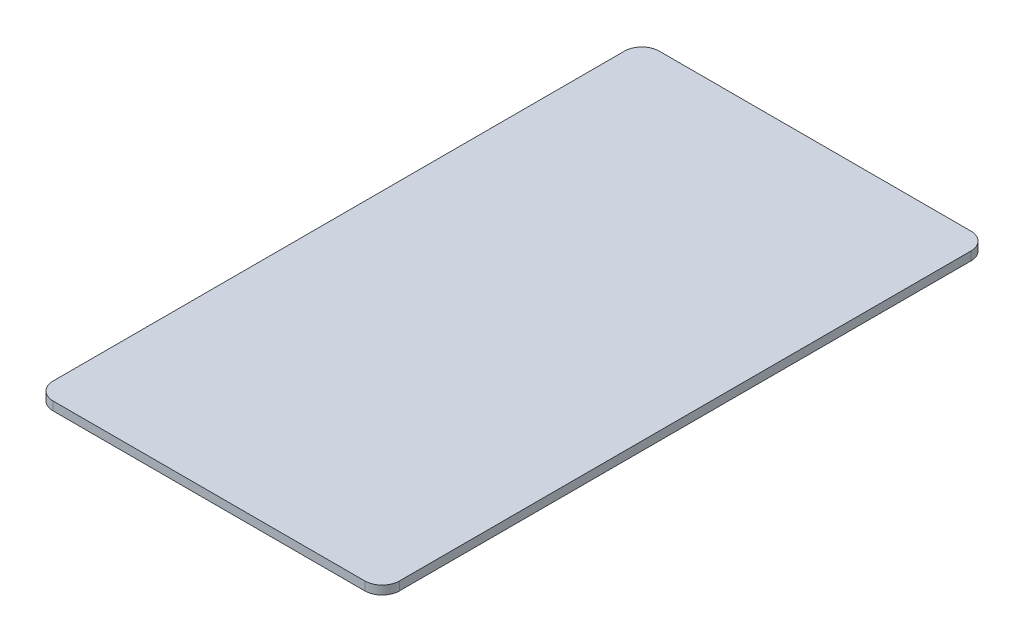
from build123d import *

# Parameters (mm, degrees)
SKETCH1_W           = 40
SKETCH1_H           = 70
BOSS_EXTRUDE1_DEPTH = 1
FILLET1_R           = 2


with BuildPart() as part:
    # Sketch1 → Boss-Extrude1 (new body)
    with BuildSketch(Plane(origin=(0, 0, 0), x_dir=(1, 0, 0), z_dir=(0, 1, 0))):
        Rectangle(SKETCH1_W, SKETCH1_H)
    extrude(amount=BOSS_EXTRUDE1_DEPTH)

    # Fillet1
    fillet1_edges = [part.edges().sort_by_distance(p)[0] for p in [
        (20, 0.5, 35),
        (-20, 0.5, 35),
        (-20, 0.5, -35),
        (20, 0.5, -35),
    ]]
    fillet(fillet1_edges, radius=FILLET1_R)


solid = part.part
